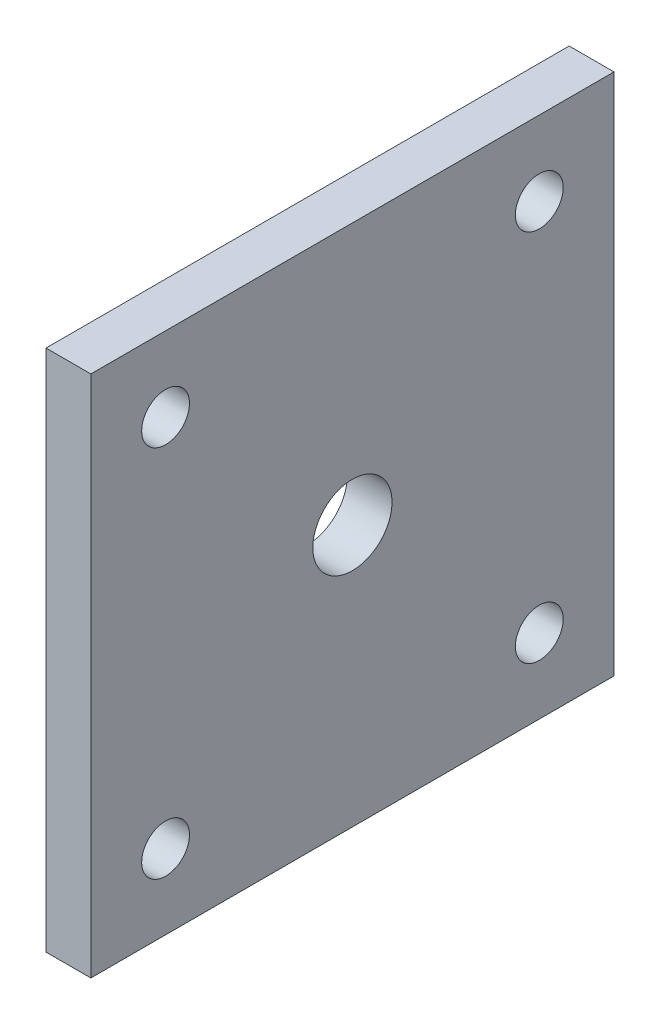
from build123d import *

# Parameters (mm, degrees)
SKETCH1_W           = 35
SKETCH1_H           = 35
BOSS_EXTRUDE1_DEPTH = 3
SKETCH2_R           = 1.6
CUT_EXTRUDE1_DEPTH  = 25.929901725
SKETCH3_R           = 2.65
CUT_EXTRUDE2_DEPTH  = 25.929901725


with BuildPart() as part:
    # Sketch1 → Boss-Extrude1 (new body)
    with BuildSketch(Plane(origin=(0, 0, 0), x_dir=(0, 0, -1), z_dir=(1, 0, 0))):
        Rectangle(SKETCH1_W, SKETCH1_H)
    extrude(amount=BOSS_EXTRUDE1_DEPTH)

    # Sketch2 → Cut-Extrude1 (cut, through all)
    with BuildSketch(Plane.ZY):
        with Locations((-12.5, 12.5)):
            Circle(SKETCH2_R)
        with Locations((-12.5, -12.5)):
            Circle(SKETCH2_R)
        with Locations((12.5, -12.5)):
            Circle(SKETCH2_R)
        with Locations((12.5, 12.5)):
            Circle(SKETCH2_R)
    extrude(amount=-CUT_EXTRUDE1_DEPTH, mode=Mode.SUBTRACT)

    # Sketch3 → Cut-Extrude2 (cut, through all)
    with BuildSketch(Plane.ZY):
        Circle(SKETCH3_R)
    extrude(amount=-CUT_EXTRUDE2_DEPTH, mode=Mode.SUBTRACT)


solid = part.part
